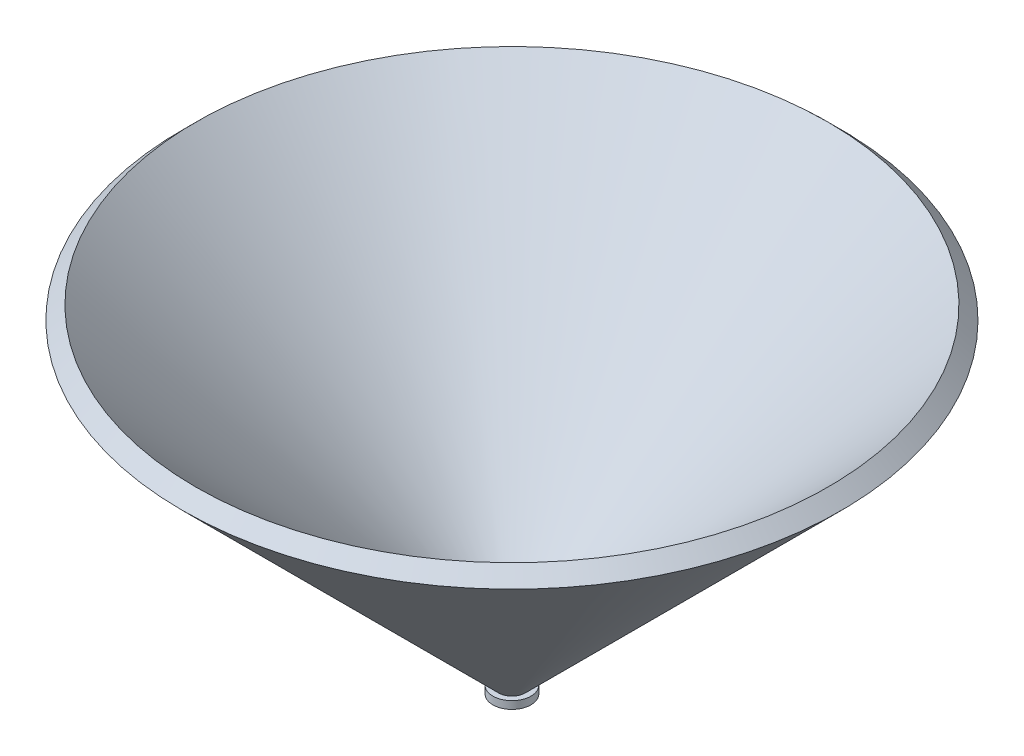
from build123d import *

# Parameters (mm, degrees)
SKETCH1_R           = 6.35
BOSS_EXTRUDE1_DEPTH = 2.54
BOSS_EXTRUDE2_DEPTH = 3.175
SKETCH3_R           = 1.27
CUT_EXTRUDE7_DEPTH  = 158.509352305


with BuildPart() as part:
    # Sketch1 → Boss-Extrude1 (new body)
    with BuildSketch(Plane(origin=(0, 0, 0), x_dir=(1, 0, 0), z_dir=(0, 1, 0))):
        Circle(SKETCH1_R)
    extrude(amount=BOSS_EXTRUDE1_DEPTH)

    # Sketch2 → Boss-Extrude2 (add, symmetric)
    with BuildSketch(Plane(origin=(0, 0, 0), x_dir=(0, 0, -1), z_dir=(1, 0, 0))):
        Polygon((105.518009423, 112.548137483), (110.008137483, 108.058009423), (4.490128061, 2.54), (0, 2.54), (0, 7.030128061), align=None)
    extrude(amount=BOSS_EXTRUDE2_DEPTH, both=True)

    # Sketch3 → Cut-Extrude7 (cut, through all)
    with BuildSketch(Plane.XZ):
        Circle(SKETCH3_R)
    extrude(amount=-CUT_EXTRUDE7_DEPTH, mode=Mode.SUBTRACT)

    # Sketch2<4> → Revolve3 (revolve)
    with BuildSketch(Plane(origin=(0, 0, 0), x_dir=(0, 0, -1), z_dir=(1, 0, 0))):
        Polygon((105.518009423, 112.548137483), (110.008137483, 108.058009423), (4.490128061, 2.54), (0, 2.54), (0, 7.030128061), align=None)
    revolve(axis=Axis((0, 2.54, 0), (0, -1, 0)))


solid = part.part
